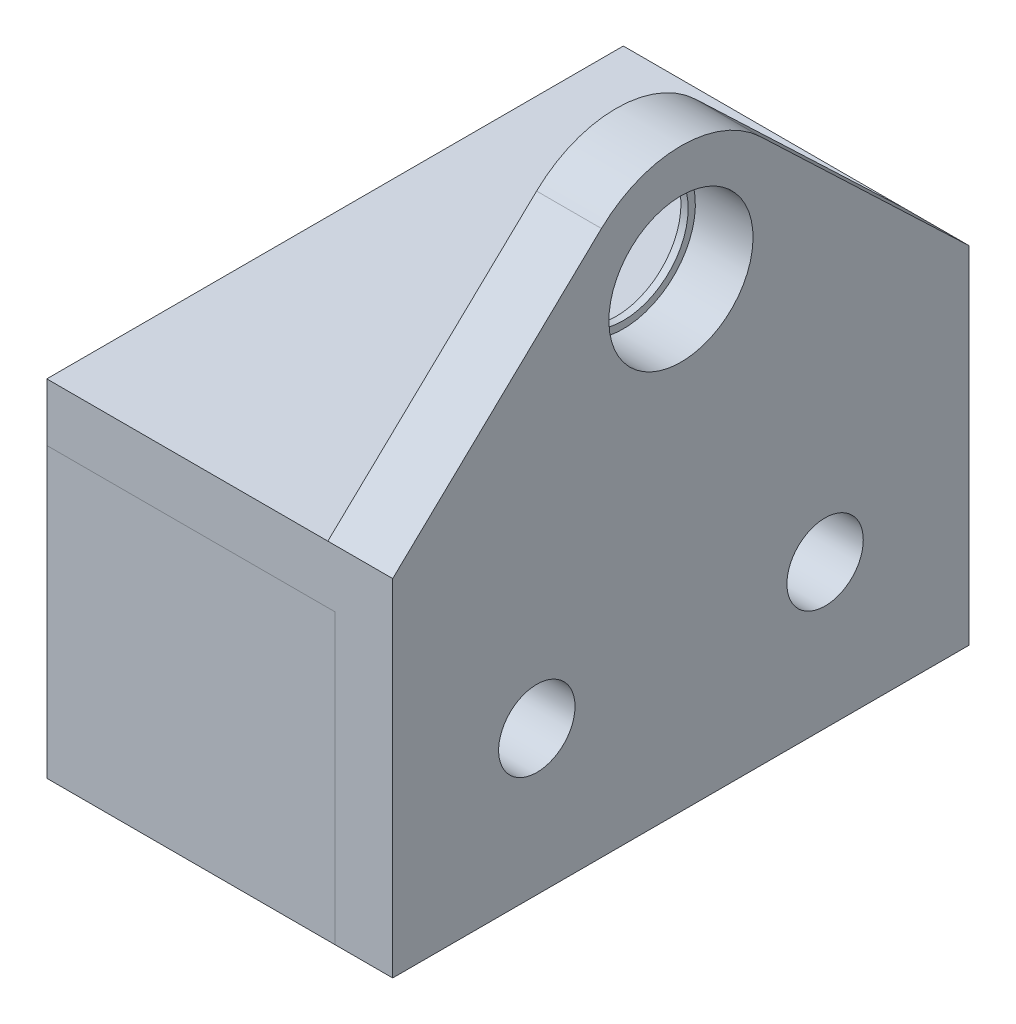
from build123d import *

# Parameters (mm, degrees)
SKETCH_2_W                 = 20
SKETCH_2_H                 = 20
EXTRUDE_1_DEPTH            = 20
SKETCH_3_W                 = 40
SKETCH_3_H                 = 24
EXTRUDE_2_DEPTH            = 4
SKETCH_5_W                 = 2.65
SKETCH_5_H                 = 24
HOLE_WIZARD_M51_AT_2_COUNT = 2
HOLE_WIZARD_M51_AT_2_PITCH = 20
SKETCH_6_W                 = 40
SKETCH_6_H                 = 4
EXTRUDE_3_DEPTH            = 20
SKETCH_7_W                 = 6.1
SKETCH_7_H                 = 8
EXTRUDE_4_DEPTH            = 3
CHAMFER_1_SIZE             = 1
SKETCH_8_R                 = 5
EXTRUDE_5_DEPTH            = 4.5
SKETCH_9_R                 = 5
SKETCH_9_R_2               = 4.5
EXTRUDE_6_DEPTH            = 0.5


with BuildPart() as part:
    # Эскиз2 → Бобышка-Вытянуть1 (new, symmetric)
    with BuildSketch(Plane.XY):
        Rectangle(SKETCH_2_W, SKETCH_2_H)
    extrude(amount=EXTRUDE_1_DEPTH, both=True)


with BuildPart() as body_2:
    # Эскиз3 → Бобышка-Вытянуть2 (new body)
    with BuildSketch(Plane(origin=(10, 0, 0), x_dir=(0, 0, -1), z_dir=(1, 0, 0))):
        with Locations((0, 2)):
            Rectangle(SKETCH_3_W, SKETCH_3_H)
    extrude(amount=EXTRUDE_2_DEPTH)

    # Эскиз5 → Отверстие с зазором M51 (revolve, cut)
    with BuildSketch(Plane(origin=(14, 0, 10), x_dir=(0, 0, -1), z_dir=(0, 1, 0))):
        with Locations((1.325, 12)):
            Rectangle(SKETCH_5_W, SKETCH_5_H)
    hole_wizard_m51 = revolve(axis=Axis((20.35, 0, 10), (-1, 0, 0)), mode=Mode.SUBTRACT)

    # Отверстие с зазором M51 at 2: Отверстие с зазором M51 ×2
    with Locations(*[(0, 0, -i * HOLE_WIZARD_M51_AT_2_PITCH) for i in range(1, HOLE_WIZARD_M51_AT_2_COUNT)]):
        add(hole_wizard_m51, mode=Mode.SUBTRACT)

    # Эскиз6 → Бобышка-Вытянуть3 (add)
    with BuildSketch(Plane.ZY.offset(-10)):
        with Locations((0, 12)):
            Rectangle(SKETCH_6_W, SKETCH_6_H)
    extrude(amount=EXTRUDE_3_DEPTH)

    # Эскиз7 → Бобышка-Вытянуть4 (add)
    with BuildSketch(Plane.XZ.offset(-10)):
        with Locations((0, 12)):
            Rectangle(SKETCH_7_W, SKETCH_7_H)
        with Locations((0, -12)):
            Rectangle(SKETCH_7_W, SKETCH_7_H)
    extrude(amount=EXTRUDE_4_DEPTH)

    # Фаска1
    chamfer_1_edges = [body_2.edges().sort_by_distance(p)[0] for p in [
        (-3.05, 7, 12),
        (3.05, 7, 12),
        (-3.05, 7, -12),
        (3.05, 7, -12),
    ]]
    chamfer(chamfer_1_edges, length=CHAMFER_1_SIZE)

    # Эскиз8 → Бобышка-Вытянуть5 (add)
    with BuildSketch(Plane(origin=(14, 0, 0), x_dir=(0, 0, -1), z_dir=(1, 0, 0))):
        with BuildLine():
            ThreePointArc((-5.517241379, 27.793103448), (0, 30), (5.517241379, 27.793103448))
            Line((5.517241379, 27.793103448), (20, 14))
            Line((20, 14), (-20, 14))
            Line((-20, 14), (-5.517241379, 27.793103448))
        make_face()
        with Locations(Location((0, 22, 0), (0, 0, 90))):
            Circle(SKETCH_8_R, mode=Mode.SUBTRACT)
    extrude(amount=-EXTRUDE_5_DEPTH)

    # Эскиз9 → Бобышка-Вытянуть6 (add)
    with BuildSketch(Plane.ZY.offset(-9.5)):
        with Locations(Location((0, 22, 0), (0, 0, 90))):
            Circle(SKETCH_9_R)
        with Locations(Location((0, 22, 0), (0, 0, 270))):
            Circle(SKETCH_9_R_2, mode=Mode.SUBTRACT)
    extrude(amount=-EXTRUDE_6_DEPTH)


solid = Compound([part.part, body_2.part])
